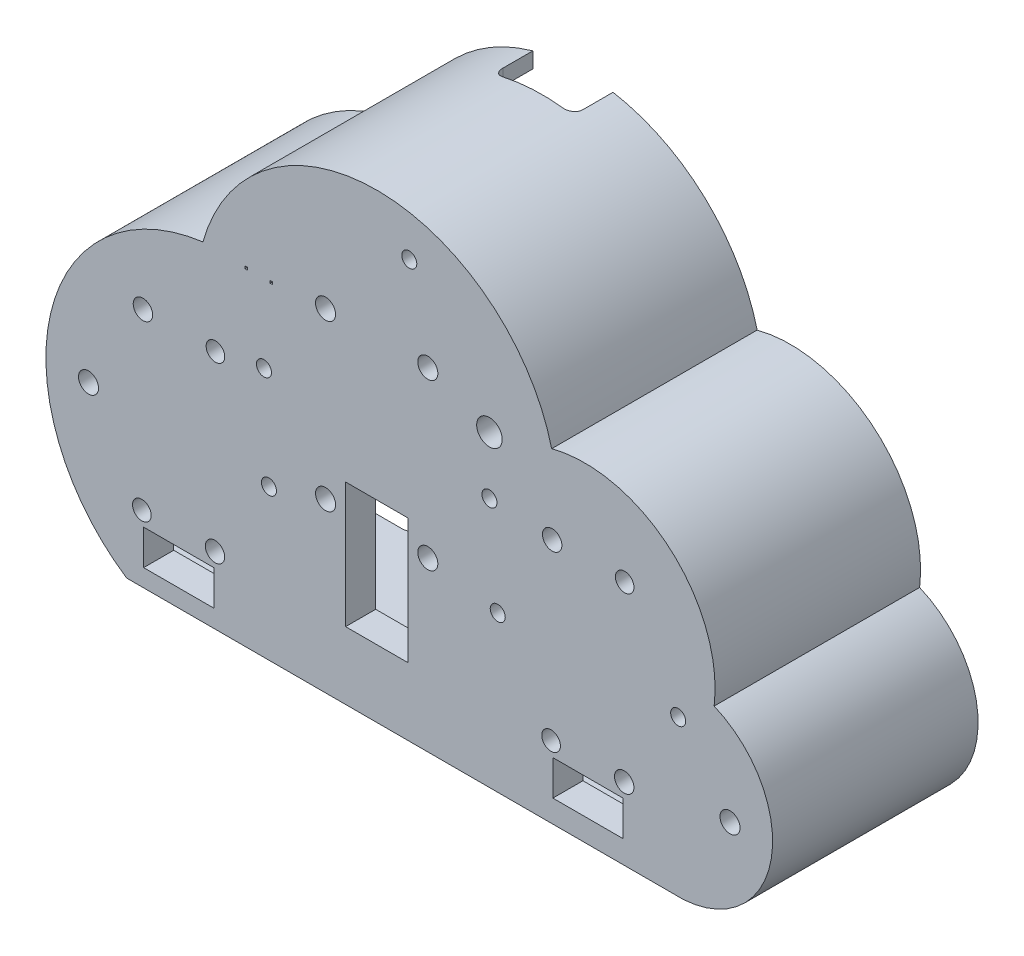
from build123d import *

# Parameters (mm, degrees)
BOSS_EXTRU_1_DEPTH           = 6
BOSS_EXTRU_2_DEPTH           = 6
BOSS_EXTRU_2_DEPTH_BACK      = 35
ENL_V_MAT_EXTRU_2_REACH      = 128.442
ESQUISSE5_W                  = 15
ESQUISSE5_H                  = 20
CONG_1_R                     = 5
ENL_V_MAT_EXTRU_3_REACH      = 128.442
ESQUISSE6_W                  = 16
ESQUISSE6_H                  = 8
ENL_V_MAT_EXTRU_4_REACH      = 105.054
ENL_V_MAT_EXTRU_4_END_RADIUS = 36
ESQUISSE7_W                  = 16
ESQUISSE7_H                  = 8
CONG_2_R                     = 2
ESQUISSE10_R                 = 2
ESQUISSE10_R_2               = 1.5
ESQUISSE10_R_3               = 1.863501178
ESQUISSE10_R_4               = 1.93430269
ESQUISSE10_R_5               = 1.939737899
ESQUISSE10_R_6               = 1.854627201
ESQUISSE10_R_7               = 2.55
ESQUISSE10_W                 = 12.4
ESQUISSE10_H                 = 25
ESQUISSE10_W_2               = 0.5
ESQUISSE10_H_2               = 0.5
ENL_V_MAT_EXTRU_6_DEPTH      = 104.053910907


with BuildPart() as part:
    # Esquisse2 → Boss.-Extru.1 (new body)
    with BuildSketch(Plane.XY):
        with BuildLine():
            Line((-48.608879521, -52.647186827), (61.474409074, -52.647186827))
            ThreePointArc((61.474409074, -52.647186827), (76.298877159, -38.117787006), (64.302141331, -21.178287526))
            ThreePointArc((64.302141331, -21.178287526), (56.703051449, 1.556908822), (33.007522473, 5.184197975))
            ThreePointArc((33.007522473, 5.184197975), (1.426097383, 33.335688366), (-31.902467285, 7.276148862))
            ThreePointArc((-31.902467285, 7.276148862), (-61.424642208, -16.783685992), (-48.608879521, -52.647186827))
        make_face()
    extrude(amount=BOSS_EXTRU_1_DEPTH)

    # Esquisse3 → Boss.-Extru.2 (add, two sides: drawn at the far end of the back side and taken through both)
    with BuildSketch(Plane.XY.offset(-BOSS_EXTRU_2_DEPTH_BACK)):
        with BuildLine():
            Line((-49.534861191, -55.647186827), (61.574237986, -55.647186827))
            ThreePointArc((61.574237986, -55.647186827), (79.101164774, -39.829765432), (67.696496182, -19.158105688))
            ThreePointArc((67.696496182, -19.158105688), (58.974577176, 3.560965394), (35.280810603, 9.113756361))
            ThreePointArc((35.280810603, 9.113756361), (0.847370614, 36.349555954), (-34.306277728, 10.0499062))
            ThreePointArc((-34.306277728, 10.0499062), (-64.707061967, -17.516732287), (-49.534861191, -55.647186827))
        make_face()
        with BuildLine():
            Line((-48.608879521, -52.647186827), (61.474409074, -52.647186827))
            ThreePointArc((61.474409074, -52.647186827), (76.298877159, -38.117787006), (64.302141331, -21.178287526))
            ThreePointArc((64.302141331, -21.178287526), (56.703051449, 1.556908822), (33.007522473, 5.184197975))
            ThreePointArc((33.007522473, 5.184197975), (1.426097383, 33.335688366), (-31.902467285, 7.276148862))
            ThreePointArc((-31.902467285, 7.276148862), (-61.424642208, -16.783685992), (-48.608879521, -52.647186827))
        make_face(mode=Mode.SUBTRACT)
    extrude(amount=BOSS_EXTRU_2_DEPTH + BOSS_EXTRU_2_DEPTH_BACK)

    # Esquisse5 → Enlèv. mat.-Extru.2 (cut, up to next)
    with BuildSketch(Plane.XZ.offset(55.647186827), mode=Mode.PRIVATE) as enl_v_mat_extru_2_sk1:
        with Locations((6.019688397, -25)):
            Rectangle(ESQUISSE5_W, ESQUISSE5_H)
    enl_v_mat_extru_2_tool1 = extrude(enl_v_mat_extru_2_sk1.sketch, amount=-ENL_V_MAT_EXTRU_2_REACH, mode=Mode.PRIVATE) & part.part
    add(enl_v_mat_extru_2_tool1.solids().sort_by_distance((6.019688, -55.647187, -25))[0], mode=Mode.SUBTRACT)

    # Congé1
    cong_1_edges = [part.edges().sort_by_distance(p)[0] for p in [
        (13.519688397, -54.147186827, -15),
        (-1.480311603, -54.147186827, -15),
    ]]
    fillet(cong_1_edges, radius=CONG_1_R)

    # Esquisse6 → Enlèv. mat.-Extru.3 (cut, up to next)
    with BuildSketch(Plane.XZ.offset(55.647186827), mode=Mode.PRIVATE) as enl_v_mat_extru_3_sk1:
        with Locations((-33.480311603, -31)):
            Rectangle(ESQUISSE6_W, ESQUISSE6_H)
    enl_v_mat_extru_3_tool1 = extrude(enl_v_mat_extru_3_sk1.sketch, amount=-ENL_V_MAT_EXTRU_3_REACH, mode=Mode.PRIVATE) & part.part
    # Esquisse6 → Enlèv. mat.-Extru.3 (cut, up to next)
    with BuildSketch(Plane.XZ.offset(55.647186827), mode=Mode.PRIVATE) as enl_v_mat_extru_3_sk2:
        with Locations((48.519688397, -31)):
            Rectangle(ESQUISSE6_W, ESQUISSE6_H)
    enl_v_mat_extru_3_tool2 = extrude(enl_v_mat_extru_3_sk2.sketch, amount=-ENL_V_MAT_EXTRU_3_REACH, mode=Mode.PRIVATE) & part.part
    add(enl_v_mat_extru_3_tool1.solids().sort_by_distance((-33.480312, -55.647187, -31))[0], mode=Mode.SUBTRACT)
    add(enl_v_mat_extru_3_tool2.solids().sort_by_distance((48.519688, -55.647187, -31))[0], mode=Mode.SUBTRACT)

    # Enlèv. mat.-Extru.4: up to this cylinder (the profile starts inside it)
    enl_v_mat_extru_4_end = Plane(origin=(0.363109154, 0.352813173, -31), z_dir=(0, 0, -1)) * Cylinder(ENL_V_MAT_EXTRU_4_END_RADIUS, 283.108, mode=Mode.PRIVATE)
    # Esquisse7 → Enlèv. mat.-Extru.4 (cut, up to the surface)
    with BuildSketch(Plane(origin=(0, 0, 0), x_dir=(1, 0, 0), z_dir=(0, 1, 0)), mode=Mode.PRIVATE) as enl_v_mat_extru_4_sk1:
        with Locations((-1.480311603, 31)):
            Rectangle(ESQUISSE7_W, ESQUISSE7_H)
    enl_v_mat_extru_4_tool1 = extrude(enl_v_mat_extru_4_sk1.sketch, amount=ENL_V_MAT_EXTRU_4_REACH, mode=Mode.PRIVATE) & enl_v_mat_extru_4_end
    add(enl_v_mat_extru_4_tool1.solids().sort_by_distance((-1.480312, 0, -31))[0], mode=Mode.SUBTRACT)

    # Congé2
    cong_2_edges = [part.edges().sort_by_distance(p)[0] for p in [
        (-9.480311603, 33.415741443, -27),
        (6.519688397, 34.297950888, -27),
        (40.519688397, -54.147186827, -27),
        (56.519688397, -54.147186827, -27),
        (-41.480311603, -54.147186827, -27),
        (-25.480311603, -54.147186827, -27),
    ]]
    fillet(cong_2_edges, radius=CONG_2_R)

    # Esquisse10 → Enlèv. mat.-Extru.6 (cut, through all)
    with BuildSketch(Plane.XY):
        with Locations((-57.135320842, -25.647186827)):
            Circle(ESQUISSE10_R)
        with Locations((10.563109154, -22.147186827)):
            Circle(ESQUISSE10_R)
        with Locations((10.563109154, 10.752813173)):
            Circle(ESQUISSE10_R)
        with Locations((-9.836890846, 10.752813173)):
            Circle(ESQUISSE10_R)
        with Locations((-22.136890846, -5.697186827)):
            Circle(ESQUISSE10_R_2)
        with Locations((22.863109154, -5.697186827)):
            Circle(ESQUISSE10_R_2)
        with Locations((-9.836890846, -22.147186827)):
            Circle(ESQUISSE10_R)
        with Locations((70.864679158, -37.647186827)):
            Circle(ESQUISSE10_R)
        with Locations((6.864679158, 27.587526086)):
            Circle(ESQUISSE10_R_2)
        with Locations((-46.489752539, -42.38368966)):
            Circle(ESQUISSE10_R_3)
        with Locations((-31.89810954, -42.24093029)):
            Circle(ESQUISSE10_R_4)
        with Locations((-46.278226209, -7.591233185)):
            Circle(ESQUISSE10_R_5)
        with Locations((-31.810577097, -7.638641543)):
            Circle(ESQUISSE10_R_6)
        with Locations((-21.135320842, -25.647186827)):
            Circle(ESQUISSE10_R_2)
        with Locations((60.519688397, -24.647186827)):
            Circle(ESQUISSE10_R_2)
        with Locations((24.519688397, -24.647186827)):
            Circle(ESQUISSE10_R_2)
        with Locations((35.37678303, -6.591233185)):
            Circle(ESQUISSE10_R_5)
        with Locations((49.844432143, -6.638641543)):
            Circle(ESQUISSE10_R_6)
        with Locations((49.7568997, -41.24093029)):
            Circle(ESQUISSE10_R_4)
        with Locations((35.165256701, -41.38368966)):
            Circle(ESQUISSE10_R_3)
        with Locations((22.863109154, 5.752813173)):
            Circle(ESQUISSE10_R_7)
        with Locations((0.363109154, -29.697186827)):
            Rectangle(ESQUISSE10_W, ESQUISSE10_H)
        Polygon((-46.135320842, -49.647186827), (-46.135320842, -45.147186827), (-32.135320842, -45.147186827), (-32.135320842, -49.647186827), (-32.135320842, -52.147186827), (-46.135320842, -52.147186827), align=None)
        Polygon((35.519688397, -48.647186827), (35.519688397, -44.147186827), (49.519688397, -44.147186827), (49.519688397, -48.647186827), (49.519688397, -51.147186827), (35.519688397, -51.147186827), align=None)
        with Locations((-20.636890846, 9.852813173)):
            Rectangle(ESQUISSE10_W_2, ESQUISSE10_H_2)
        with Locations((-25.636890846, 9.852813173)):
            Rectangle(ESQUISSE10_W_2, ESQUISSE10_H_2)
    extrude(amount=ENL_V_MAT_EXTRU_6_DEPTH, mode=Mode.SUBTRACT)


solid = part.part
